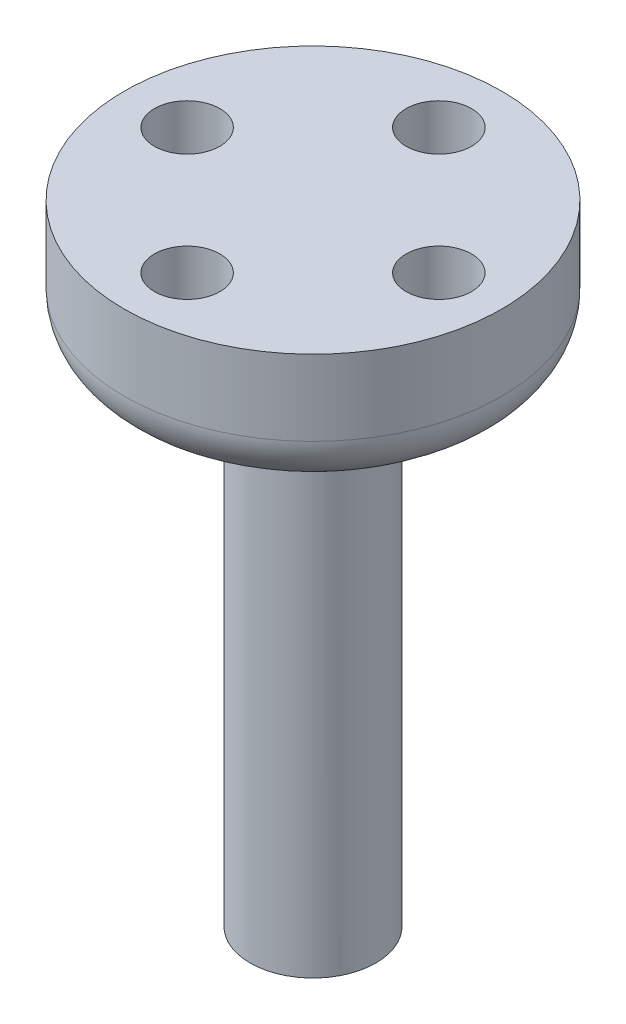
from build123d import *

# Parameters (mm, degrees)
SKETCH1_R           = 7.5
BOSS_EXTRUDE1_DEPTH = 5
SKETCH2_R           = 1.3
CUT_EXTRUDE1_DEPTH  = 3
FILLET1_R           = 2
SKETCH3_R           = 2.5
BOSS_EXTRUDE2_DEPTH = 20


with BuildPart() as part:
    # Sketch1 → Boss-Extrude1 (new body)
    with BuildSketch(Plane(origin=(0, 0, 0), x_dir=(1, 0, 0), z_dir=(0, 1, 0))):
        with Locations(Location((0, 0, 0), (0, 0, 270))):
            Circle(SKETCH1_R)
    extrude(amount=BOSS_EXTRUDE1_DEPTH)

    # Sketch2 → Cut-Extrude1 (cut)
    with BuildSketch(Plane(origin=(0, 5, 0), x_dir=(1, 0, 0), z_dir=(0, 1, 0))):
        with Locations(Location((0, 5, 0), (0, 0, 270))):
            Circle(SKETCH2_R)
        with Locations(Location((5, 0, 0), (0, 0, 270))):
            Circle(SKETCH2_R)
        with Locations(Location((0, -5, 0), (0, 0, 270))):
            Circle(SKETCH2_R)
        with Locations(Location((-5, 0, 0), (0, 0, 270))):
            Circle(SKETCH2_R)
    extrude(amount=-CUT_EXTRUDE1_DEPTH, mode=Mode.SUBTRACT)

    # Fillet1
    fillet1_edges = [part.edges().sort_by_distance(p)[0] for p in [
        (0, 0, -7.5),
    ]]
    fillet(fillet1_edges, radius=FILLET1_R)

    # Sketch3 → Boss-Extrude2 (add)
    with BuildSketch(Plane.XZ):
        with Locations(Location((0, 0, 0), (0, 0, 90))):
            Circle(SKETCH3_R)
    extrude(amount=BOSS_EXTRUDE2_DEPTH)


solid = part.part
